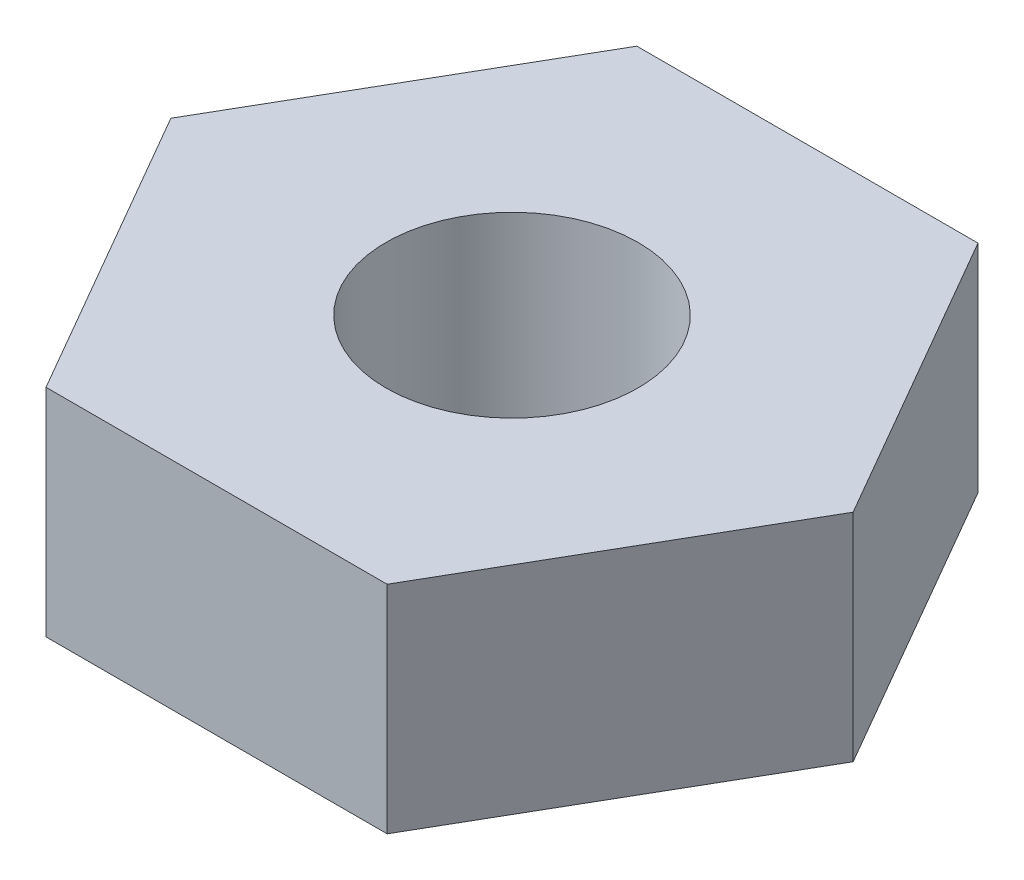
from build123d import *

# Parameters (mm, degrees)
CROQUIS1_R              = 1.75
SALIENTE_EXTRUIR1_DEPTH = 3


with BuildPart() as part:
    # Croquis1 → Saliente-Extruir1 (new body)
    with BuildSketch(Plane(origin=(0, 0, 0), x_dir=(1, 0, 0), z_dir=(0, 1, 0))):
        Polygon((4.734272207, 0), (2.367136104, 4.1), (-2.367136104, 4.1), (-4.734272207, 0), (-2.367136104, -4.1), (2.367136104, -4.1), align=None)
        with Locations(Location((0, 0, 0), (0, 0, 270))):
            Circle(CROQUIS1_R, mode=Mode.SUBTRACT)
    extrude(amount=SALIENTE_EXTRUIR1_DEPTH)


solid = part.part
